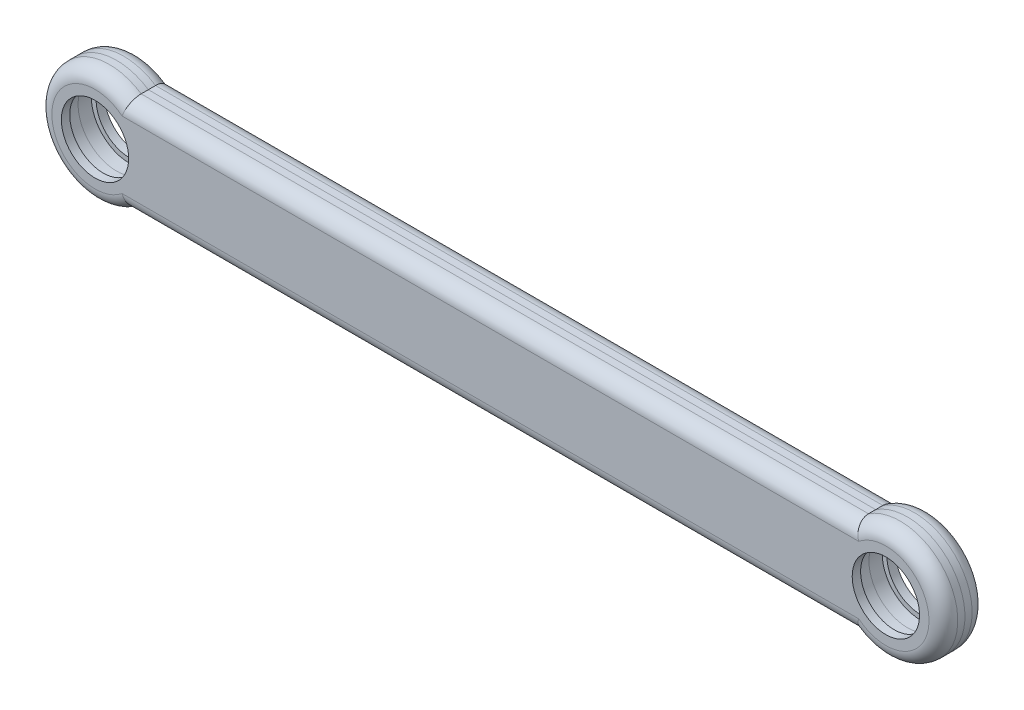
from build123d import *

# Parameters (mm, degrees)
BOSS_EXTRUDE1_DEPTH     = 4.5
SKETCH6_23_R            = 8.025
CUT_EXTRUDE1_DEPTH      = 2.75
CUT_EXTRUDE2_DEPTH      = 178.463376503
CUT_EXTRUDE2_DEPTH_BACK = 178.463376503
SKETCH6_24_R            = 7.025
FILLET1_R               = 3


with BuildPart() as part:
    # Sketch6 → Boss-Extrude1 (new, symmetric)
    with BuildSketch(Plane.XY):
        with BuildLine():
            Line((6.633249581, -10), (158.366750419, -10))
            ThreePointArc((158.366750419, -10), (177, 0), (158.366750419, 10))
            Line((158.366750419, 10), (6.633249581, 10))
            ThreePointArc((6.633249581, 10), (-12, 0), (6.633249581, -10))
        make_face()
    extrude(amount=BOSS_EXTRUDE1_DEPTH, both=True)

    # Sketch6<23> → Cut-Extrude1 (cut, symmetric)
    with BuildSketch(Plane.XY):
        Circle(SKETCH6_23_R)
        with Locations((165, 0)):
            Circle(SKETCH6_23_R)
    extrude(amount=CUT_EXTRUDE1_DEPTH, both=True, mode=Mode.SUBTRACT)

    # Sketch6<24> → Cut-Extrude2 (cut, two sides: drawn at the far end of the back side and taken through both)
    with BuildSketch(Plane.XY.offset(-CUT_EXTRUDE2_DEPTH_BACK)):
        Circle(SKETCH6_24_R)
        with Locations((165, 0)):
            Circle(SKETCH6_24_R)
    extrude(amount=CUT_EXTRUDE2_DEPTH + CUT_EXTRUDE2_DEPTH_BACK, mode=Mode.SUBTRACT)

    # Fillet1
    fillet1_edges = [part.edges().sort_by_distance(p)[0] for p in [
        (-12, 0, 4.5),
        (177, 0, 4.5),
        (82.5, -10, 4.5),
        (82.5, 10, 4.5),
        (82.5, -10, -4.5),
        (82.5, 10, -4.5),
        (177, 0, -4.5),
        (-12, 0, -4.5),
    ]]
    fillet(fillet1_edges, radius=FILLET1_R)


with BuildPart() as body_2:
    # Split1: the piece on the far side of the plane
    add(part.part)
    split(bisect_by=Plane.XY, keep=Keep.BOTTOM)


with BuildPart() as part_1:
    add(part.part)

    # Split1
    split(bisect_by=Plane.XY, keep=Keep.TOP)


solid = Compound([body_2.part, part_1.part])
